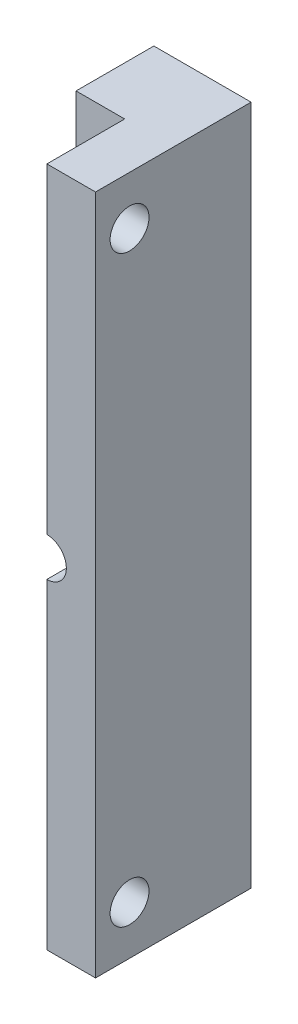
from build123d import *
from build123d.topology import SkipClean

# Parameters (mm, degrees)
EXTRUDE_1_DEPTH      = 14
CUT_EXTRUDE_1_DEPTH  = 44
SKETCH_3_W           = 6.2
SKETCH_3_H           = 6.2
CUT_EXTRUDE_2_DEPTH  = 4
SKETCH_4_R           = 4
CUT_EXTRUDE_3_DEPTH  = 5
SKETCH_5_R           = 2.6
CUT_EXTRUDE_4_DEPTH  = 5
SKETCH_6_W           = 5
SKETCH_6_H           = 44
CUT_EXTRUDE_5_DEPTH  = 10
SKETCH_7_W           = 5
SKETCH_7_H           = 44
CUT_EXTRUDE_6_DEPTH  = 10
EXTRUDE_3_DEPTH      = 48
EXTRUDE_4_DEPTH      = 48
SKETCH_11_W          = 22
SKETCH_11_H          = 140
EXTRUDE_5_DEPTH      = 20
SKETCH_12_R          = 4
CUT_EXTRUDE_7_DEPTH  = 20
SKETCH_13_W          = 10
SKETCH_13_H          = 16
CUT_EXTRUDE_8_DEPTH  = 140
CUT_EXTRUDE_9_DEPTH  = 6
SKETCH_15_R          = 4
CUT_EXTRUDE_10_DEPTH = 20
SKETCH_16_W          = 6.2
SKETCH_16_H          = 22
CUT_EXTRUDE_11_DEPTH = 4


with BuildPart() as part:
    # 草图1 → 凸台-拉伸1 (new body)
    with BuildSketch(Plane.XY):
        Polygon((-15, 22), (-15, -22), (15, -22), (15, 22), (0, 22), align=None)
    extrude(amount=EXTRUDE_1_DEPTH)

    # 草图2 → 切除-拉伸1 (cut)
    with BuildSketch(Plane(origin=(0, 22, 0), x_dir=(1, 0, 0), z_dir=(0, 1, 0))):
        Polygon((-15, 0), (-15, -14), (-10, -4), (-3.1, -4), (-3.1, 0), align=None)
        Polygon((3.1, -4), (10, -4), (15, -14), (15, 0), (3.1, 0), align=None)
    extrude(amount=-CUT_EXTRUDE_1_DEPTH, mode=Mode.SUBTRACT)

    # 草图3 → 切除-拉伸2 (cut)
    with BuildSketch(Plane(origin=(0, 0, 0), x_dir=(-1, 0, 0), z_dir=(0, 0, -1))):
        Rectangle(SKETCH_3_W, SKETCH_3_H)
    extrude(amount=-CUT_EXTRUDE_2_DEPTH, mode=Mode.SUBTRACT)

    # 草图4 → 切除-拉伸3 (cut)
    with BuildSketch(Plane.XY.offset(14)):
        Circle(SKETCH_4_R)
    extrude(amount=-CUT_EXTRUDE_3_DEPTH, mode=Mode.SUBTRACT)

    # 草图5 → 切除-拉伸4 (cut)
    with BuildSketch(Plane.XY.offset(9)):
        Circle(SKETCH_5_R)
    extrude(amount=-CUT_EXTRUDE_4_DEPTH, mode=Mode.SUBTRACT)

    # 草图6 → 切除-拉伸5 (cut)
    with BuildSketch(Plane(origin=(0, 0, 4), x_dir=(-1, 0, 0), z_dir=(0, 0, -1))):
        with Locations((12.5, 0)):
            Rectangle(SKETCH_6_W, SKETCH_6_H)
    extrude(amount=-CUT_EXTRUDE_5_DEPTH, mode=Mode.SUBTRACT)

    # 草图7 → 切除-拉伸6 (cut)
    with BuildSketch(Plane(origin=(0, 0, 4), x_dir=(-1, 0, 0), z_dir=(0, 0, -1))):
        with Locations((-12.5, 0)):
            Rectangle(SKETCH_7_W, SKETCH_7_H)
    extrude(amount=-CUT_EXTRUDE_6_DEPTH, mode=Mode.SUBTRACT)

    # 草图9 → 凸台-拉伸3 (add)
    with BuildSketch(Plane(origin=(0, 22, 0), x_dir=(1, 0, 0), z_dir=(0, 1, 0))):
        Polygon((-3.1, 0), (3.1, 0), (3.1, -4), (10, -4), (10, -14), (-10, -14), (-10, -4), (-3.1, -4), align=None)
    extrude(amount=EXTRUDE_3_DEPTH)

    # 草图10 → 凸台-拉伸4 (add)
    with BuildSketch(Plane(origin=(0, -22, 0), x_dir=(-1, 0, 0), z_dir=(0, -1, 0))):
        Polygon((10, -14), (-10, -14), (-10, -4), (-3.1, -4), (-3.1, 0), (3.1, 0), (3.1, -4), (10, -4), align=None)
    extrude(amount=EXTRUDE_4_DEPTH)

    # 草图11 → 凸台-拉伸5 (add)
    with BuildSketch(Plane(origin=(10, 0, 0), x_dir=(0, 0, -1), z_dir=(1, 0, 0))):
        with Locations((-25, 0)):
            Rectangle(SKETCH_11_W, SKETCH_11_H)
    extrude(amount=-EXTRUDE_5_DEPTH)

    # 草图12 → 切除-拉伸7 (cut)
    with BuildSketch(Plane(origin=(10, 0, 0), x_dir=(0, 0, -1), z_dir=(1, 0, 0))):
        with Locations((-29, 60)):
            Circle(SKETCH_12_R)
        with Locations((-29, -60)):
            Circle(SKETCH_12_R)
    extrude(amount=-CUT_EXTRUDE_7_DEPTH, mode=Mode.SUBTRACT)

    # 草图13 → 切除-拉伸8 (cut)
    with BuildSketch(Plane.XZ.offset(70)):
        with Locations((-5, 28)):
            Rectangle(SKETCH_13_W, SKETCH_13_H)
    extrude(amount=-CUT_EXTRUDE_8_DEPTH, mode=Mode.SUBTRACT)

    # 草图14 → 切除-拉伸9 (cut)
    with BuildSketch(Plane.XY.offset(20)):
        with BuildLine():
            ThreePointArc((4, 0), (2.828427125, 2.828427125), (0, 4))
            Line((0, 4), (0, -4))
            ThreePointArc((0, -4), (2.828427125, -2.828427125), (4, 0))
        make_face()
        with BuildLine():
            Line((0, -4), (0, 4))
            ThreePointArc((0, 4), (-4, 0), (0, -4))
        make_face()
    extrude(amount=-CUT_EXTRUDE_9_DEPTH, mode=Mode.SUBTRACT)

    # 草图15 → 切除-拉伸10 (cut)
    with SkipClean():  # the faces are left unmerged after this step: merging them gives an invalid solid
        with BuildSketch(Plane.XY.offset(36)):
            Circle(SKETCH_15_R)
        extrude(amount=-CUT_EXTRUDE_10_DEPTH, mode=Mode.SUBTRACT)

    # 草图16 → 切除-拉伸11 (cut)
    with SkipClean():  # the faces are left unmerged after this step: merging them gives an invalid solid
        with BuildSketch(Plane(origin=(0, 0, 0), x_dir=(-1, 0, 0), z_dir=(0, 0, -1))):
            with Locations((0, 59)):
                Rectangle(SKETCH_16_W, SKETCH_16_H)
            with Locations((0, -59)):
                Rectangle(SKETCH_16_W, SKETCH_16_H)
        extrude(amount=-CUT_EXTRUDE_11_DEPTH, mode=Mode.SUBTRACT)


solid = part.part
